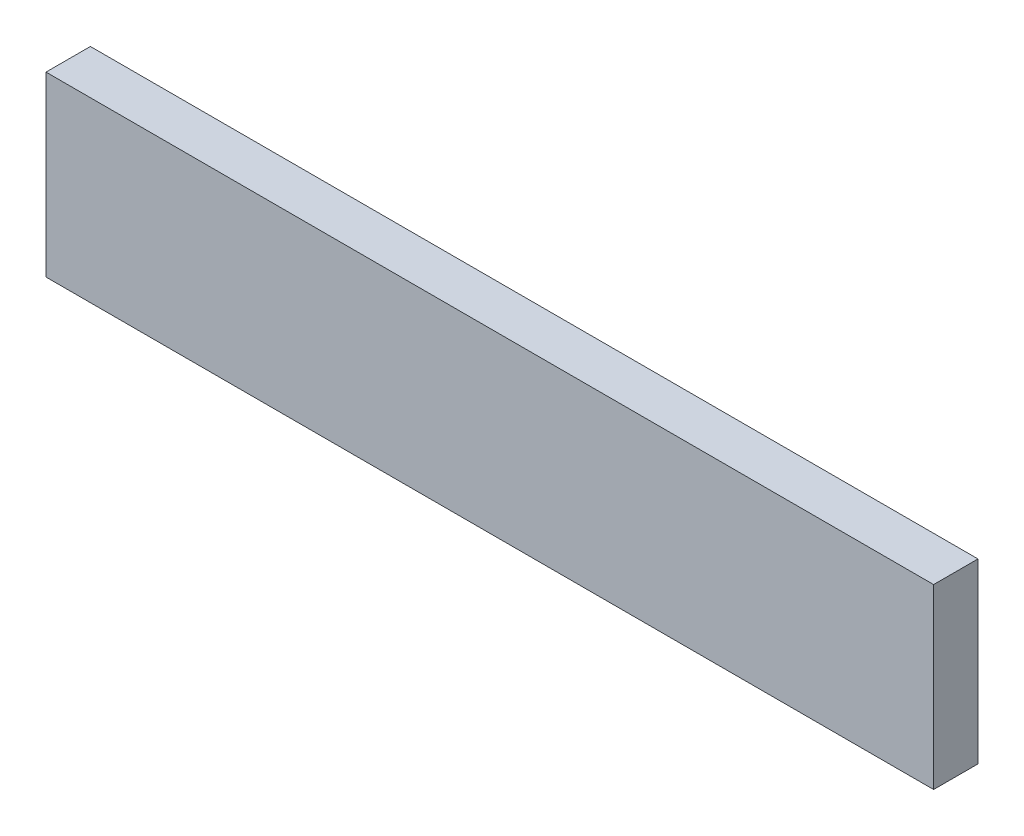
from build123d import *

# Parameters (mm, degrees)
CROQUIS1_W              = 1000
CROQUIS1_H              = 200
SALIENTE_EXTRUIR1_DEPTH = 50


with BuildPart() as part:
    # Croquis1 → Saliente-Extruir1 (new body)
    with BuildSketch(Plane.XY):
        with Locations((47.834702312, 85.387673956)):
            Rectangle(CROQUIS1_W, CROQUIS1_H)
    extrude(amount=SALIENTE_EXTRUIR1_DEPTH)


solid = part.part
